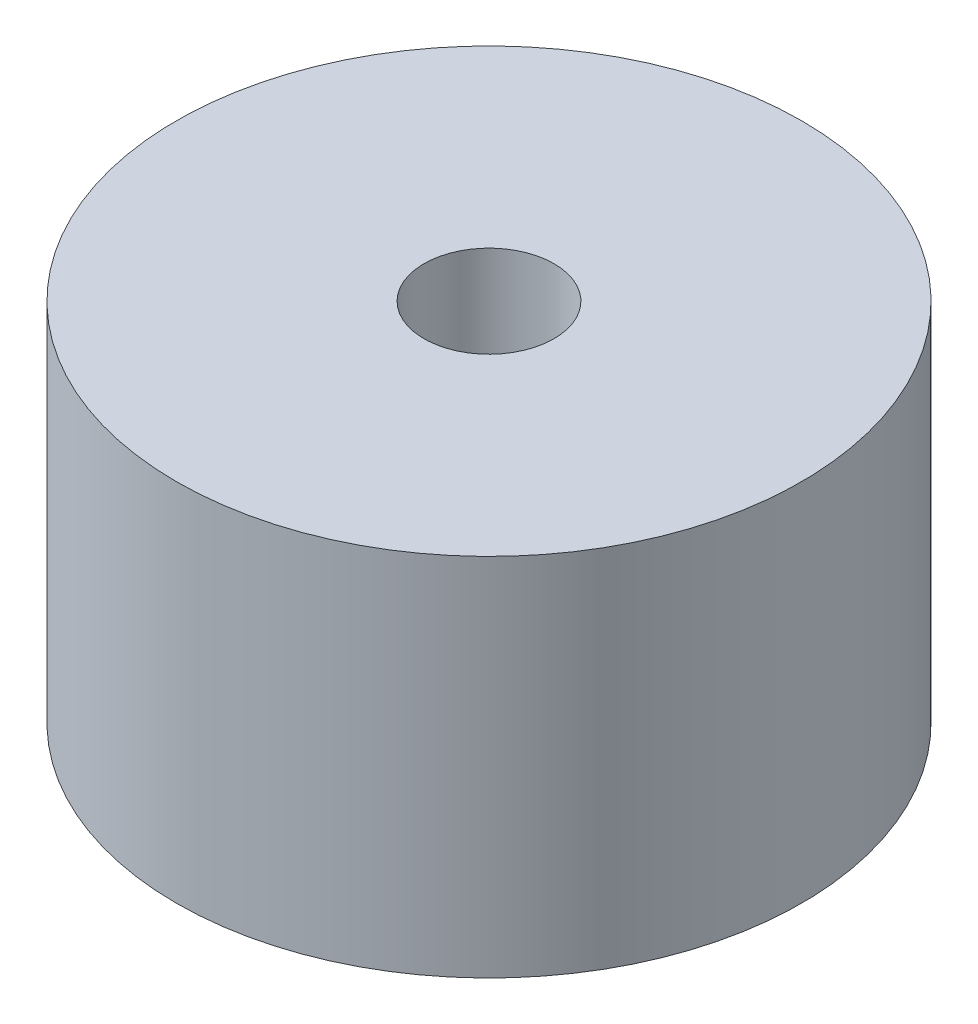
from build123d import *

# Parameters (mm, degrees)
SKETCH_1_R          = 12.5
EXTRUDE_1_DEPTH     = 14.6
SKETCH_3_R          = 2.6
CUT_EXTRUDE_1_DEPTH = 23.927276332


with BuildPart() as part:
    # 草图1 → 凸台-拉伸1 (new body)
    with BuildSketch(Plane(origin=(0, 0, 0), x_dir=(1, 0, 0), z_dir=(0, 1, 0))):
        with Locations(Location((0, 0, 0), (0, 0, 270))):
            Circle(SKETCH_1_R)
    extrude(amount=EXTRUDE_1_DEPTH)

    # 草图3 → 切除-拉伸1 (cut, through all)
    with BuildSketch(Plane.XZ):
        with Locations(Location((0, 0, 0), (0, 0, 270))):
            Circle(SKETCH_3_R)
    extrude(amount=-CUT_EXTRUDE_1_DEPTH, mode=Mode.SUBTRACT)


solid = part.part
